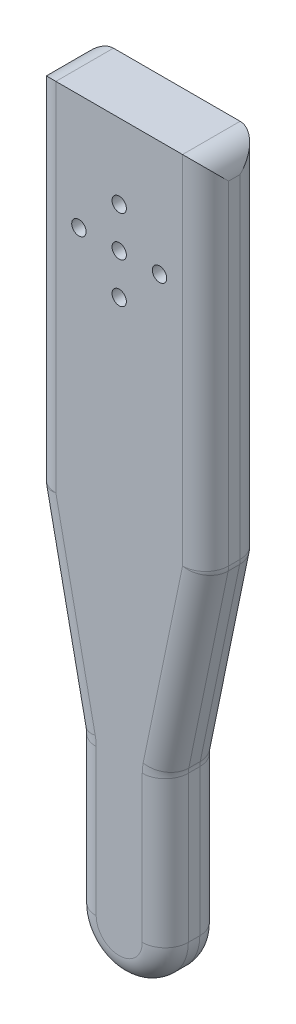
from build123d import *

# Parameters (mm, degrees)
SKETCH2_W             = 30
SKETCH2_H             = 130
BOSS_EXTRUDE1_DEPTH   = 10
M3X0_5_TAPPED_HOLE2_D = 2.5
CUT_EXTRUDE3_DEPTH    = 75.64013832
FILLET3_RADIUS        = 8
FILLET3_LENGTH        = 10
FILLET4_R             = 4
M3X0_5_TAPPED_HOLE3_D = 2.5


with BuildPart() as part:
    # Sketch2 → Boss-Extrude1 (new body)
    with BuildSketch(Plane.XY):
        with Locations((-14.802371542, -2.697628458)):
            Rectangle(SKETCH2_W, SKETCH2_H)
    extrude(amount=BOSS_EXTRUDE1_DEPTH)

    # M3x0.5 Tapped Hole2 (through all)
    with Locations(Plane.XY.offset(10)):
        with Locations((-14.802371542, 35.302371542), (-21.802371542, 42.302371542), (-14.802371542, 49.302371542), (-7.802371542, 42.302371542)):
            Hole(M3X0_5_TAPPED_HOLE2_D / 2)

    # Sketch6 → Cut-Extrude3 (cut, through all)
    with BuildSketch(Plane.XY.offset(10)):
        Polygon((-29.802371542, -67.697628458), (-22.802371542, -67.697628458), (-22.802371542, -33.848814229), (-29.802371542, 0), align=None)
        Polygon((0.197628458, -67.697628458), (-6.802371542, -67.697628458), (-6.802371542, -33.848814229), (0.197628458, 0), align=None)
    extrude(amount=-CUT_EXTRUDE3_DEPTH, mode=Mode.SUBTRACT)

    # Fillet3: full round fillet: the end face becomes a half cylinder, R = half its width
    fillet3_face = Plane((-14.802371542, -67.697628458, 5), x_dir=(0, 0, 1), z_dir=(0, -1, 0))  # on the end face: x along it, z out of the body
    fillet3_slab = fillet3_face.offset(-FILLET3_RADIUS / 2) * Box(FILLET3_LENGTH, 2 * FILLET3_RADIUS, FILLET3_RADIUS, mode=Mode.PRIVATE)  # the body's end, R deep
    fillet3_round = Plane((-14.802371542, -59.697628458, 5), x_dir=(0, -1, 0), z_dir=(0, 0, 1)) * Cylinder(FILLET3_RADIUS, FILLET3_LENGTH, mode=Mode.PRIVATE)  # its axis R under the face
    add(fillet3_slab - fillet3_round, mode=Mode.SUBTRACT)

    # Fillet4
    fillet4_edges = [part.edges().sort_by_distance(p)[0] for p in [
        (0.197628458, 31.151185771, 0),
        (0.197628458, 31.151185771, 10),
        (-3.302371542, -16.924407115, 10),
        (-6.802371542, -33.848814229, 5),
        (0.197628458, 0, 5),
        (-3.302371542, -16.924407115, 0),
        (-29.802371542, 31.151185771, 10),
        (-26.302371542, -16.924407115, 10),
        (-29.802371542, 0, 5),
        (-22.802371542, -33.848814229, 5),
        (-26.302371542, -16.924407115, 0),
        (-29.802371542, 31.151185771, 0),
        (-22.802371542, -46.773221344, 10),
        (-22.802371542, -46.773221344, 0),
        (-6.802371542, -46.773221344, 10),
        (-6.802371542, -46.773221344, 0),
        (-14.802371542, -67.697628458, 0),
        (-14.802371542, -67.697628458, 10),
        (-29.802371542, 62.302371542, 5),
        (0.197628458, 62.302371542, 5),
    ]]
    fillet(fillet4_edges, radius=FILLET4_R)

    # M3x0.5 Tapped Hole3 (through all)
    with Locations(Plane.XY.offset(10)):
        with Locations((-14.802371542, 42.302371542)):
            Hole(M3X0_5_TAPPED_HOLE3_D / 2)


solid = part.part
